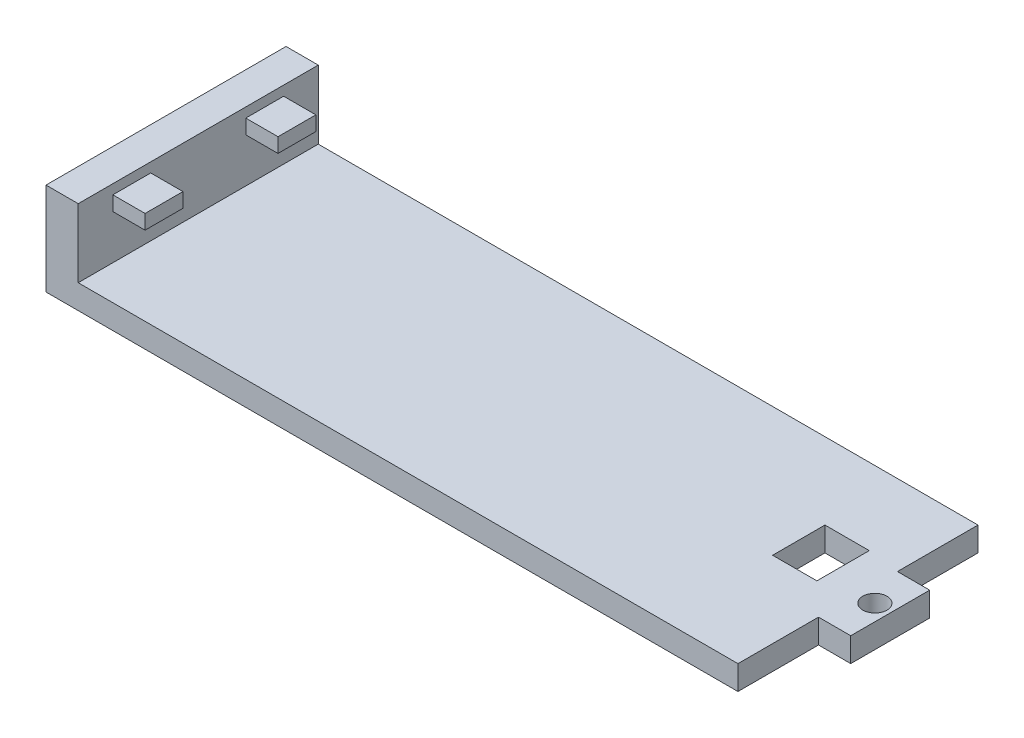
from build123d import *

# Parameters (mm, degrees)
SKETCH1_W           = 89.9
SKETCH1_H           = 29.8
BOSS_EXTRUDE1_DEPTH = 3
SKETCH8_R           = 1.5
SKETCH8_W           = 4
SKETCH8_H           = 10
CUT_EXTRUDE5_DEPTH  = 5
SKETCH12_W          = 5.5
SKETCH12_H          = 6.5
CUT_EXTRUDE8_DEPTH  = 10
SKETCH15_W          = 4
SKETCH15_H          = 29.8
BOSS_EXTRUDE2_DEPTH = 8.5
SKETCH16_W          = 4.7
SKETCH16_H          = 1.8
BOSS_EXTRUDE3_DEPTH = 4


with BuildPart() as part:
    # Sketch1 → Boss-Extrude1 (new body)
    with BuildSketch(Plane(origin=(0, 0, 0), x_dir=(1, 0, 0), z_dir=(0, 1, 0))):
        with Locations((44.95, 14.9)):
            Rectangle(SKETCH1_W, SKETCH1_H)
    extrude(amount=BOSS_EXTRUDE1_DEPTH)

    # Sketch8 → Cut-Extrude5 (cut)
    with BuildSketch(Plane(origin=(0, 0, 0), x_dir=(-1, 0, 0), z_dir=(0, -1, 0))):
        with Locations(Location((-87.9, 15, 0), (0, 0, 90))):
            Circle(SKETCH8_R)
        with Locations((-87.9, 5)):
            Rectangle(SKETCH8_W, SKETCH8_H)
        with Locations((-87.9, 24.8)):
            Rectangle(SKETCH8_W, SKETCH8_H)
    extrude(amount=-CUT_EXTRUDE5_DEPTH, mode=Mode.SUBTRACT)

    # Sketch12 → Cut-Extrude8 (cut)
    with BuildSketch(Plane.XZ):
        with Locations((79.15, -17.05)):
            Rectangle(SKETCH12_W, SKETCH12_H)
    extrude(amount=-CUT_EXTRUDE8_DEPTH, mode=Mode.SUBTRACT)

    # Sketch15 → Boss-Extrude2 (add)
    with BuildSketch(Plane(origin=(0, 3, 0), x_dir=(1, 0, 0), z_dir=(0, 1, 0))):
        with Locations((2, 14.9)):
            Rectangle(SKETCH15_W, SKETCH15_H)
    extrude(amount=BOSS_EXTRUDE2_DEPTH)

    # Sketch16 → Boss-Extrude3 (add)
    with BuildSketch(Plane(origin=(4, 0, 0), x_dir=(0, 0, -1), z_dir=(1, 0, 0))):
        with Locations((6.65, 9.4)):
            Rectangle(SKETCH16_W, SKETCH16_H)
        with Locations((23.15, 9.4)):
            Rectangle(SKETCH16_W, SKETCH16_H)
    extrude(amount=BOSS_EXTRUDE3_DEPTH)


solid = part.part
